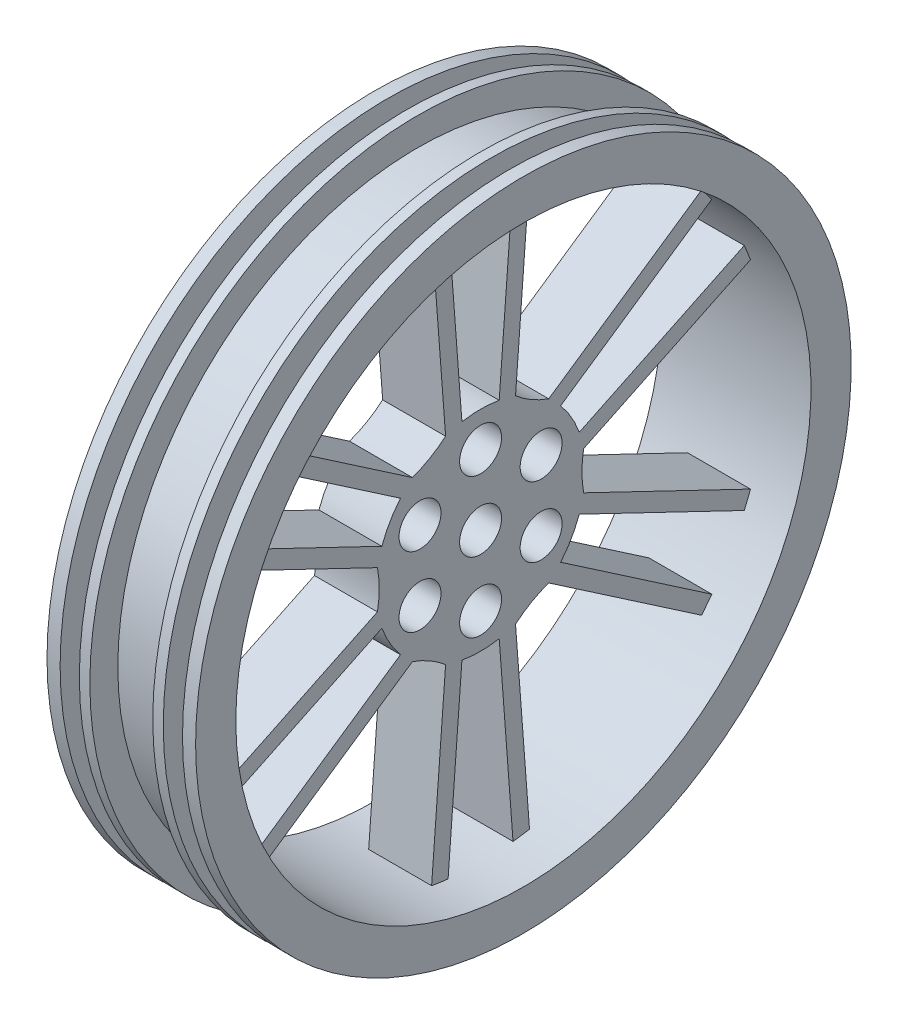
from build123d import *

# Parameters (mm, degrees)
SKETCH1_R           = 2.4
BOSS_EXTRUDE1_DEPTH = 3.6


with BuildPart() as part:
    # Top → Base (revolve)
    with BuildSketch(Plane(origin=(0, 0, 0), x_dir=(1, 0, 0), z_dir=(0, 1, 0)), mode=Mode.PRIVATE) as base_sk:
        Polygon((-8.5, 32.9), (-8.5, 37.5), (-7, 37.5), (-7, 34.3), (-4.8, 34.3), (-4.8, 37.5), (-3.6, 37.5), (-3.6, 34.3), (3.6, 34.3), (3.6, 37.5), (4.8, 37.5), (4.8, 34.3), (7, 34.3), (7, 37.5), (8.5, 37.5), (8.5, 32.9), align=None)
    revolve(base_sk.sketch.rotate(Axis((0, 0, 0), (1, 0, 0)), 180), axis=Axis((0, 0, 0), (1, 0, 0)))

    # Sketch1 → Boss-Extrude1 (add, symmetric)
    with BuildSketch(Plane(origin=(0, 0, 0), x_dir=(0, 0, -1), z_dir=(1, 0, 0))):
        with BuildLine():
            Line((-2.132100415, 11.809070574), (-3.714992228, 32.689582939))
            ThreePointArc((-3.714992228, 32.689582939), (-4.659447617, 32.568382642), (-5.6, 32.419901295))
            Line((-5.6, 32.419901295), (-4, 11.313708499))
            ThreePointArc((-4, 11.313708499), (-5.797958971, 10.042359518), (-7.797958971, 9.120955865))
            Line((-7.797958971, 9.120955865), (-25.27645811, 21.059692909))
            ThreePointArc((-25.27645811, 21.059692909), (-25.875322919, 20.319391325), (-26.452513151, 19.562069114))
            Line((-26.452513151, 19.562069114), (-9.160904905, 7.75098841))
            ThreePointArc((-9.160904905, 7.75098841), (-10.392304845, 6), (-11.29300532, 4.058082164))
            Line((-11.29300532, 4.058082164), (-30.167505379, 13.127513825))
            ThreePointArc((-30.167505379, 13.127513825), (-30.534770537, 12.248991317), (-30.87645811, 11.360208386))
            Line((-30.87645811, 11.360208386), (-11.797958971, 2.192752634))
            ThreePointArc((-11.797958971, 2.192752634), (-11.595917942, 0), (-11.797958971, -2.192752634))
            Line((-11.797958971, -2.192752634), (-30.87645811, -11.360208386))
            ThreePointArc((-30.87645811, -11.360208386), (-30.534770537, -12.248991317), (-30.167505379, -13.127513825))
            Line((-30.167505379, -13.127513825), (-11.29300532, -4.058082164))
            ThreePointArc((-11.29300532, -4.058082164), (-10.392304845, -6), (-9.160904905, -7.75098841))
            Line((-9.160904905, -7.75098841), (-26.452513151, -19.562069114))
            ThreePointArc((-26.452513151, -19.562069114), (-25.875322919, -20.319391325), (-25.27645811, -21.059692909))
            Line((-25.27645811, -21.059692909), (-7.797958971, -9.120955865))
            ThreePointArc((-7.797958971, -9.120955865), (-5.797958971, -10.042359518), (-4, -11.313708499))
            Line((-4, -11.313708499), (-5.6, -32.419901295))
            ThreePointArc((-5.6, -32.419901295), (-4.659447617, -32.568382642), (-3.714992228, -32.689582939))
            Line((-3.714992228, -32.689582939), (-2.132100415, -11.809070574))
            ThreePointArc((-2.132100415, -11.809070574), (0, -12), (2.132100415, -11.809070574))
            Line((2.132100415, -11.809070574), (3.714992228, -32.689582939))
            ThreePointArc((3.714992228, -32.689582939), (4.659447617, -32.568382642), (5.6, -32.419901295))
            Line((5.6, -32.419901295), (4, -11.313708499))
            ThreePointArc((4, -11.313708499), (5.797958971, -10.042359518), (7.797958971, -9.120955865))
            Line((7.797958971, -9.120955865), (25.27645811, -21.059692909))
            ThreePointArc((25.27645811, -21.059692909), (25.875322919, -20.319391325), (26.452513151, -19.562069114))
            Line((26.452513151, -19.562069114), (9.160904905, -7.75098841))
            ThreePointArc((9.160904905, -7.75098841), (10.392304845, -6), (11.29300532, -4.058082164))
            Line((11.29300532, -4.058082164), (30.167505379, -13.127513825))
            ThreePointArc((30.167505379, -13.127513825), (30.534770537, -12.248991317), (30.87645811, -11.360208386))
            Line((30.87645811, -11.360208386), (11.797958971, -2.192752634))
            ThreePointArc((11.797958971, -2.192752634), (11.595917942, 0), (11.797958971, 2.192752634))
            Line((11.797958971, 2.192752634), (30.87645811, 11.360208386))
            ThreePointArc((30.87645811, 11.360208386), (30.534770537, 12.248991317), (30.167505379, 13.127513825))
            Line((30.167505379, 13.127513825), (11.29300532, 4.058082164))
            ThreePointArc((11.29300532, 4.058082164), (10.392304845, 6), (9.160904905, 7.75098841))
            Line((9.160904905, 7.75098841), (26.452513151, 19.562069114))
            ThreePointArc((26.452513151, 19.562069114), (25.875322919, 20.319391325), (25.27645811, 21.059692909))
            Line((25.27645811, 21.059692909), (7.797958971, 9.120955865))
            ThreePointArc((7.797958971, 9.120955865), (5.797958971, 10.042359518), (4, 11.313708499))
            Line((4, 11.313708499), (5.6, 32.419901295))
            ThreePointArc((5.6, 32.419901295), (4.659447617, 32.568382642), (3.714992228, 32.689582939))
            Line((3.714992228, 32.689582939), (2.132100415, 11.809070574))
            ThreePointArc((2.132100415, 11.809070574), (0, 12), (-2.132100415, 11.809070574))
        make_face()
        with Locations((0, 8)):
            Circle(SKETCH1_R, mode=Mode.SUBTRACT)
        Circle(SKETCH1_R, mode=Mode.SUBTRACT)
        with Locations((-6.92820323, 4)):
            Circle(SKETCH1_R, mode=Mode.SUBTRACT)
        with Locations((-6.92820323, -4)):
            Circle(SKETCH1_R, mode=Mode.SUBTRACT)
        with Locations((0, -8)):
            Circle(SKETCH1_R, mode=Mode.SUBTRACT)
        with Locations((6.92820323, -4)):
            Circle(SKETCH1_R, mode=Mode.SUBTRACT)
        with Locations((6.92820323, 4)):
            Circle(SKETCH1_R, mode=Mode.SUBTRACT)
    extrude(amount=BOSS_EXTRUDE1_DEPTH, both=True)


solid = part.part
